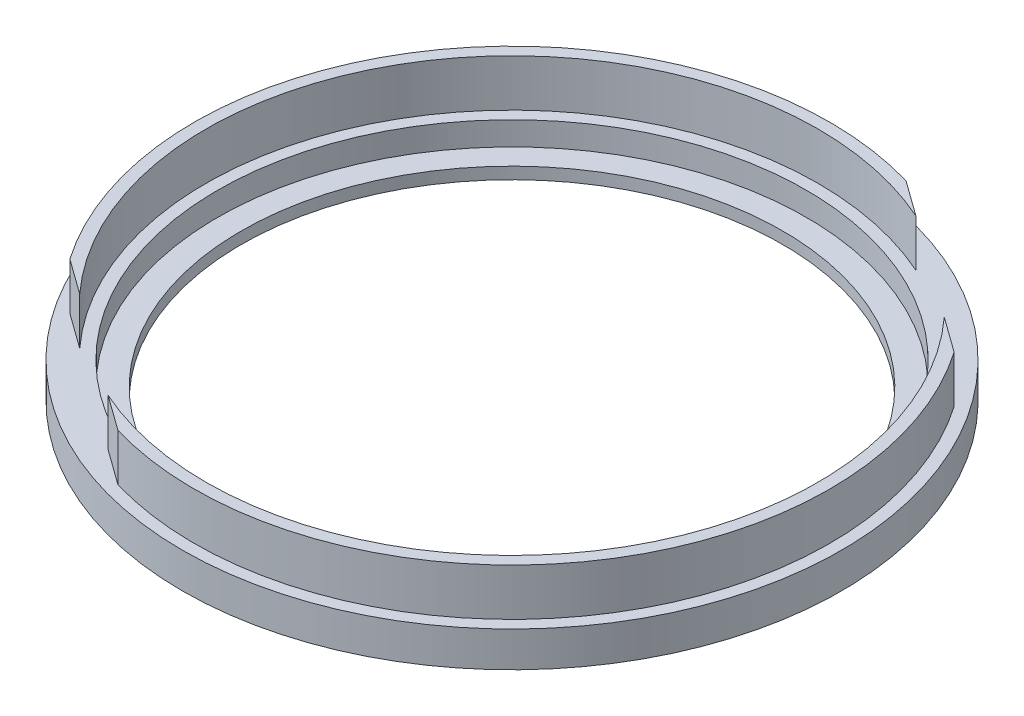
from build123d import *

# Parameters (mm, degrees)
ESQUISSE6_R             = 28
BOSS_EXTRU_3_DEPTH      = 3
ESQUISSE7_R             = 27
ESQUISSE7_R_2           = 26
BOSS_EXTRU_4_DEPTH      = 4
ESQUISSE8_R             = 25
ENL_V_MAT_EXTRU_2_DEPTH = 2
ESQUISSE9_R             = 23
ENL_V_MAT_EXTRU_3_DEPTH = 102.549659352
ENL_V_MAT_EXTRU_4_DEPTH = 4


with BuildPart() as part:
    # Esquisse6 → Boss.-Extru.3 (new body)
    with BuildSketch(Plane(origin=(0, 0, 0), x_dir=(1, 0, 0), z_dir=(0, 1, 0))):
        with Locations(Location((-49.260149918, 37.629281188, 0), (0, 0, 270))):
            Circle(ESQUISSE6_R)
    extrude(amount=BOSS_EXTRU_3_DEPTH)

    # Esquisse7 → Boss.-Extru.4 (add)
    with BuildSketch(Plane(origin=(0, 3, 0), x_dir=(1, 0, 0), z_dir=(0, 1, 0))):
        with Locations(Location((-49.260149918, 37.629281188, 0), (0, 0, 270))):
            Circle(ESQUISSE7_R)
        with Locations(Location((-49.260149918, 37.629281188, 0), (0, 0, 270))):
            Circle(ESQUISSE7_R_2, mode=Mode.SUBTRACT)
    extrude(amount=BOSS_EXTRU_4_DEPTH)

    # Esquisse8 → Enlèv. mat.-Extru.2 (cut)
    with BuildSketch(Plane(origin=(0, 3, 0), x_dir=(1, 0, 0), z_dir=(0, 1, 0))):
        with Locations(Location((-49.260149918, 37.629281188, 0), (0, 0, 270))):
            Circle(ESQUISSE8_R)
    extrude(amount=-ENL_V_MAT_EXTRU_2_DEPTH, mode=Mode.SUBTRACT)

    # Esquisse9 → Enlèv. mat.-Extru.3 (cut, through all)
    with BuildSketch(Plane(origin=(0, 1, 0), x_dir=(1, 0, 0), z_dir=(0, 1, 0))):
        with Locations(Location((-49.260149918, 37.629281188, 0), (0, 0, 270))):
            Circle(ESQUISSE9_R)
    extrude(amount=-ENL_V_MAT_EXTRU_3_DEPTH, mode=Mode.SUBTRACT)

    # Esquisse10 → Enlèv. mat.-Extru.4 (cut)
    with BuildSketch(Plane(origin=(0, 7, 0), x_dir=(1, 0, 0), z_dir=(0, 1, 0))):
        Polygon((-71.468932312, 22.27447788), (-56.821464275, 11.709664578), (-59.381564572, 8.160241962), (-74.029032608, 18.725055265), align=None)
        Polygon((-39.138735265, 67.098320413), (-24.491267228, 56.53350711), (-27.051367525, 52.984084495), (-41.698835561, 63.548897797), align=None)
    extrude(amount=-ENL_V_MAT_EXTRU_4_DEPTH, mode=Mode.SUBTRACT)


solid = part.part
